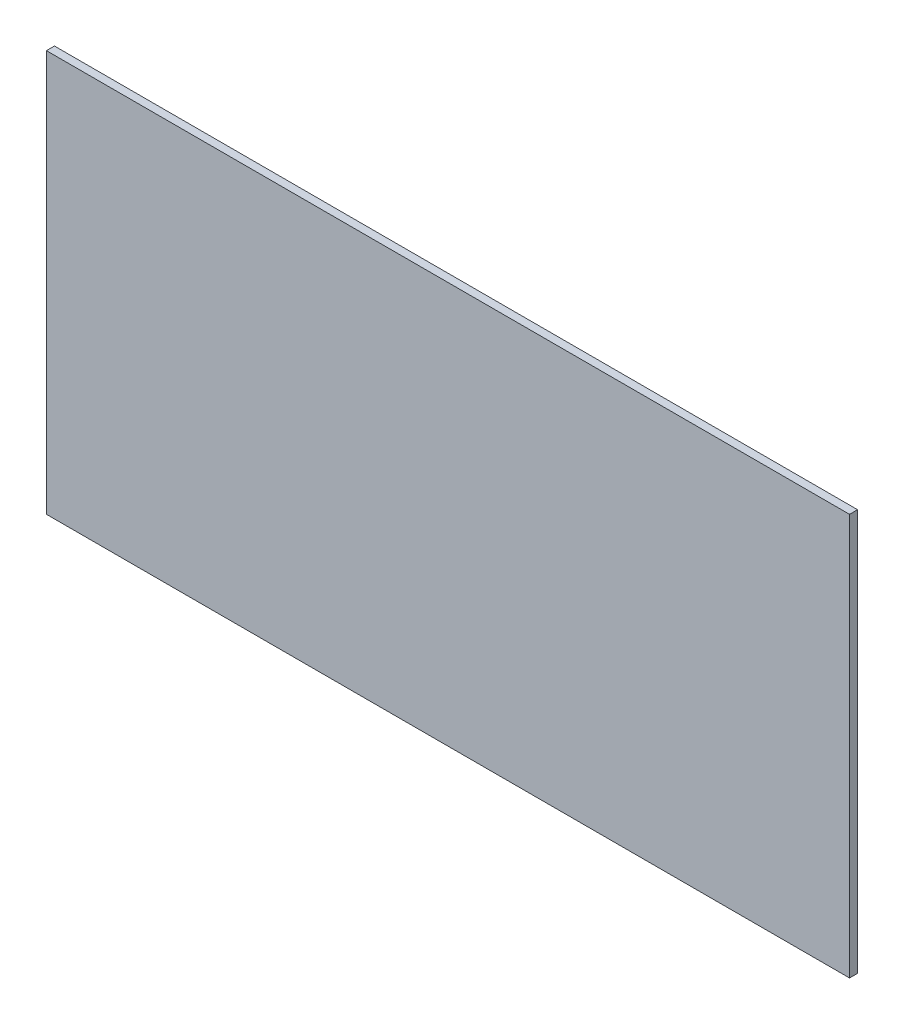
from build123d import *

# Parameters (mm, degrees)
SKETCH_1_W      = 2000
SKETCH_1_H      = 1000
EXTRUDE_1_DEPTH = 20


with BuildPart() as part:
    # 草图1 → 凸台-拉伸1 (new body)
    with BuildSketch(Plane.XY):
        Rectangle(SKETCH_1_W, SKETCH_1_H)
    extrude(amount=EXTRUDE_1_DEPTH)


solid = part.part
